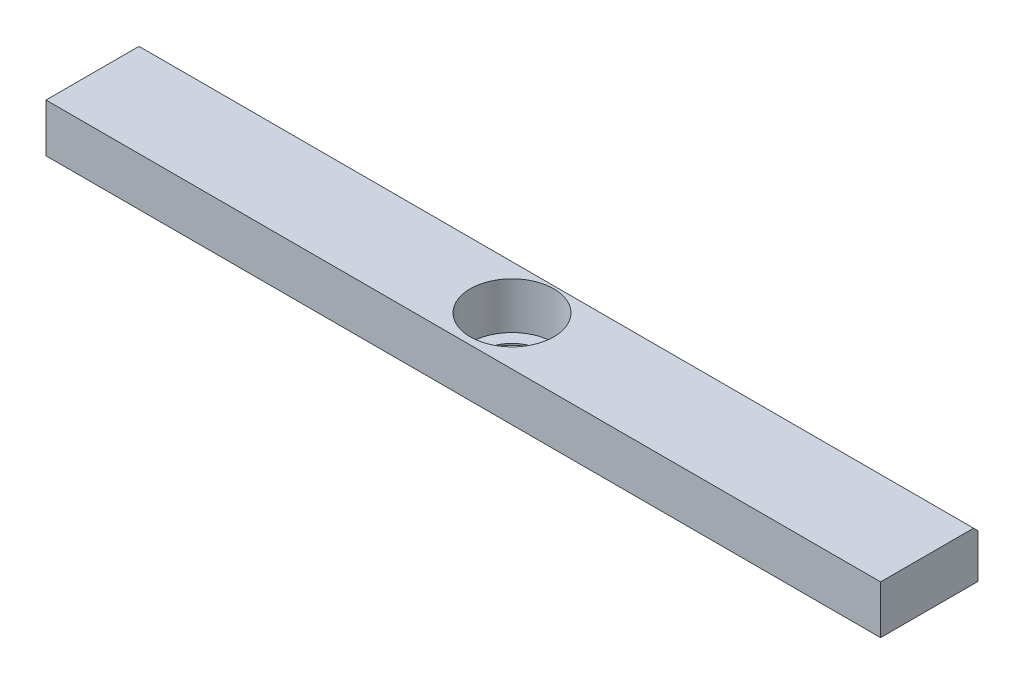
from build123d import *

# Parameters (mm, degrees)
SKETCH1_W           = 950
SKETCH1_H           = 110.864689034
BOSS_EXTRUDE1_DEPTH = 27.5
SKETCH2_R           = 47.5
CUT_EXTRUDE1_DEPTH  = 53
SKETCH3_R           = 32.5
CUT_EXTRUDE2_DEPTH  = 53
CHAMFER1_SIZE       = 5


with BuildPart() as part:
    # Sketch1 → Boss-Extrude1 (new, symmetric)
    with BuildSketch(Plane(origin=(0, 0, 0), x_dir=(1, 0, 0), z_dir=(0, 1, 0))):
        Rectangle(SKETCH1_W, SKETCH1_H)
    extrude(amount=BOSS_EXTRUDE1_DEPTH, both=True)

    # Sketch2 → Cut-Extrude1 (cut)
    with BuildSketch(Plane(origin=(0, 27.5, 0), x_dir=(1, 0, 0), z_dir=(0, 1, 0))):
        with Locations(Location((0, 0, 0), (0, 0, 270))):
            Circle(SKETCH2_R)
    extrude(amount=-CUT_EXTRUDE1_DEPTH, mode=Mode.SUBTRACT)

    # Sketch3 → Cut-Extrude2 (cut)
    with BuildSketch(Plane(origin=(0, -25.5, 0), x_dir=(1, 0, 0), z_dir=(0, 1, 0))):
        with Locations(Location((0, 0, 0), (0, 0, 270))):
            Circle(SKETCH3_R)
    extrude(amount=-CUT_EXTRUDE2_DEPTH, mode=Mode.SUBTRACT)

    # Chamfer1
    chamfer1_edges = [part.edges().sort_by_distance(p)[0] for p in [
        (0, 27.5, -55.432344517),
    ]]
    chamfer(chamfer1_edges, length=CHAMFER1_SIZE)


solid = part.part
